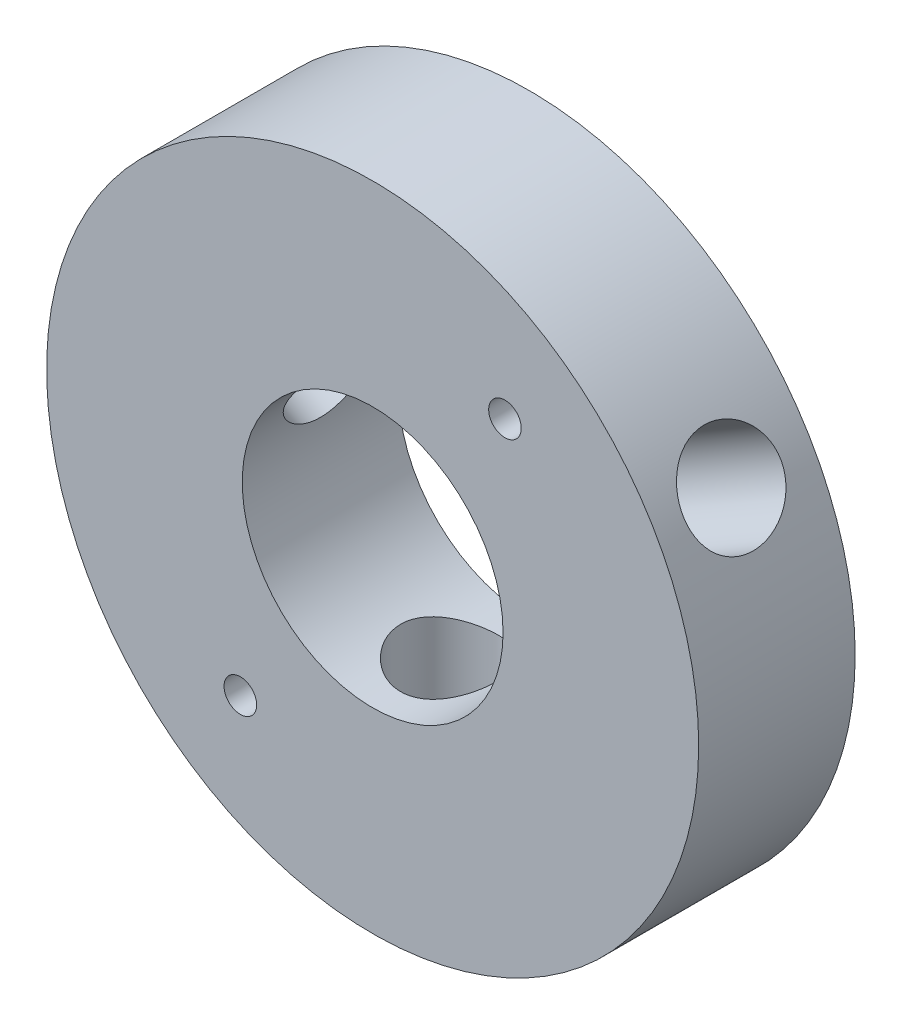
from build123d import *

# Parameters (mm, degrees)
SKETCH1_R                                = 15.875
BOSS_EXTRUDE1_DEPTH                      = 7.62
SKETCH2_R                                = 6.35
CUT_EXTRUDE1_DEPTH                       = 24.708556472
CIRPATTERN1_COUNT                        = 3
F_1_16_0_0625_DIAMETER_HOLE1_D           = 1.5875
F_1_16_0_0625_DIAMETER_HOLE1_CSINK_D     = 2.8575
F_1_16_0_0625_DIAMETER_HOLE1_CSINK_ANGLE = 100
CIRPATTERN2_COUNT                        = 2


with BuildPart() as part:
    # Sketch1 → Boss-Extrude1 (new body)
    with BuildSketch(Plane.XY):
        with Locations(Location((0, 0, 0), (0, 0, 180))):
            Circle(SKETCH1_R)
    extrude(amount=BOSS_EXTRUDE1_DEPTH)

    # Sketch2 → Cut-Extrude1 (cut, through all)
    with BuildSketch(Plane.XY.offset(7.62)):
        Circle(SKETCH2_R)
    extrude(amount=-CUT_EXTRUDE1_DEPTH, mode=Mode.SUBTRACT)

    # Sketch36 → 3/16 (0.1875) Diameter Hole1 (revolve, cut)
    with BuildSketch(Plane(origin=(0, -15.875, 3.877224023), x_dir=(0, 0, -1), z_dir=(1, 0, 0))):
        Polygon((0, 0), (0, 20.480799349), (2.38125, 19.05), (2.38125, 0), align=None)
    f_3_16_0_1875_diameter_hole1 = revolve(axis=Axis((0, -22.225, 3.877224023), (0, 1, 0)), mode=Mode.SUBTRACT)

    # CirPattern1: 3/16 (0.1875) Diameter Hole1 ×3 about axis
    cirpattern1_axis = Axis((0, 0, 7.62), (0, 0, -1))
    for i in range(1, CIRPATTERN1_COUNT):
        add(f_3_16_0_1875_diameter_hole1.rotate(cirpattern1_axis, i * 360 / CIRPATTERN1_COUNT), mode=Mode.SUBTRACT)

    # 1/16 (0.0625) Diameter Hole1 (through all)
    with Locations(Plane(origin=(0, 0, 0), x_dir=(-1, 0, 0), z_dir=(0, 0, -1))):
        with Locations((-6.442291542, 9.054531238)):
            f_1_16_0_0625_diameter_hole1 = CounterSinkHole(F_1_16_0_0625_DIAMETER_HOLE1_D / 2, F_1_16_0_0625_DIAMETER_HOLE1_CSINK_D / 2, counter_sink_angle=F_1_16_0_0625_DIAMETER_HOLE1_CSINK_ANGLE)

    # CirPattern2: 1/16 (0.0625) Diameter Hole1 ×2 about axis
    cirpattern2_axis = Axis((0, 0, 0), (0, 0, 1))
    for i in range(1, CIRPATTERN2_COUNT):
        add(f_1_16_0_0625_diameter_hole1.rotate(cirpattern2_axis, i * 360 / CIRPATTERN2_COUNT), mode=Mode.SUBTRACT)


solid = part.part
